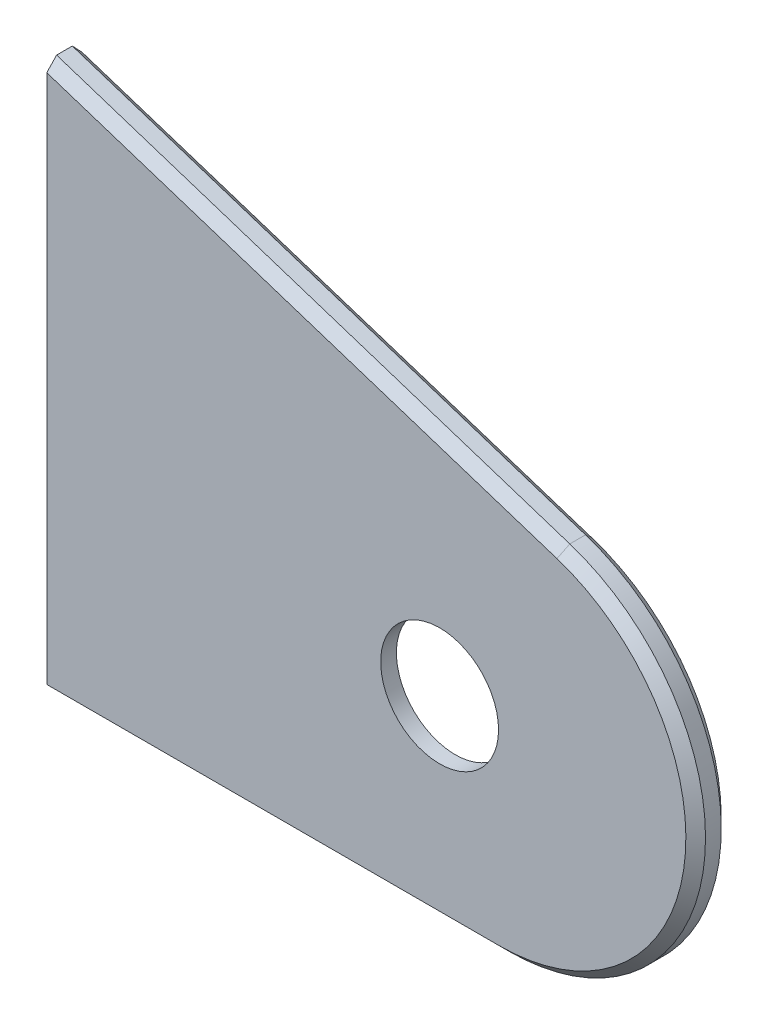
from build123d import *

# Parameters (mm, degrees)
SKETCH_1_R      = 30
EXTRUDE_1_DEPTH = 8
FILLET_1_R      = 100
EXTRUDE_2_DEPTH = 10
FILLET_2_R      = 10
CHAMFER_1_SIZE  = 5


with BuildPart() as part:
    # 草图1 → 凸台-拉伸1 (new body)
    with BuildSketch(Plane.XY):
        Polygon((0, 0), (0, 280), (861.751390409, 0), align=None)
        with Locations((200, 100)):
            Circle(SKETCH_1_R, mode=Mode.SUBTRACT)
    extrude(amount=EXTRUDE_1_DEPTH)

    # 圆角1
    fillet_1_edges = [part.edges().sort_by_distance(p)[0] for p in [
        (861.751390409, 0, 4),
    ]]
    fillet(fillet_1_edges, radius=FILLET_1_R)

    # 草图2 → 凸台-拉伸2 (add)
    with BuildSketch(Plane.XY):
        with BuildLine():
            Line((0, 0), (230.376238942, 0))
            ThreePointArc((230.376238942, 0), (329.145073001, 84.356553496), (261.277938379, 195.10565163))
            Line((261.277938379, 195.10565163), (0, 280))
            Line((0, 280), (0, 0))
        make_face()
        Polygon((10, 266.236180795), (10, 35.358983849), (122.241374643, 229.766747442), align=None, mode=Mode.SUBTRACT)
        with BuildLine():
            Line((30, 10), (230.376238942, 10))
            ThreePointArc((230.376238942, 10), (319.268189595, 85.920898146), (258.187768435, 185.595086467))
            Line((258.187768435, 185.595086467), (151.410485182, 220.289128906))
            Line((151.410485182, 220.289128906), (30, 10))
        make_face(mode=Mode.SUBTRACT)
    extrude(amount=-EXTRUDE_2_DEPTH)

    # 圆角2
    fillet_2_edges = [part.edges().sort_by_distance(p)[0] for p in [
        (122.241374643, 229.766747442, -5),
        (10, 35.358983849, -5),
        (10, 266.236180795, -5),
        (151.410485182, 220.289128906, -5),
        (30, 10, -5),
    ]]
    fillet(fillet_2_edges, radius=FILLET_2_R)

    # 倒角1
    chamfer_1_edges = [part.edges().sort_by_distance(p)[0] for p in [
        (130.63896919, 237.552825815, 8),
        (329.145073001, 84.356553496, 8),
        (130.63896919, 237.552825815, -10),
        (329.145073001, 84.356553496, -10),
        (115.188119471, 0, -10),
        (115.188119471, 0, 8),
    ]]
    chamfer(chamfer_1_edges, length=CHAMFER_1_SIZE)


solid = part.part
